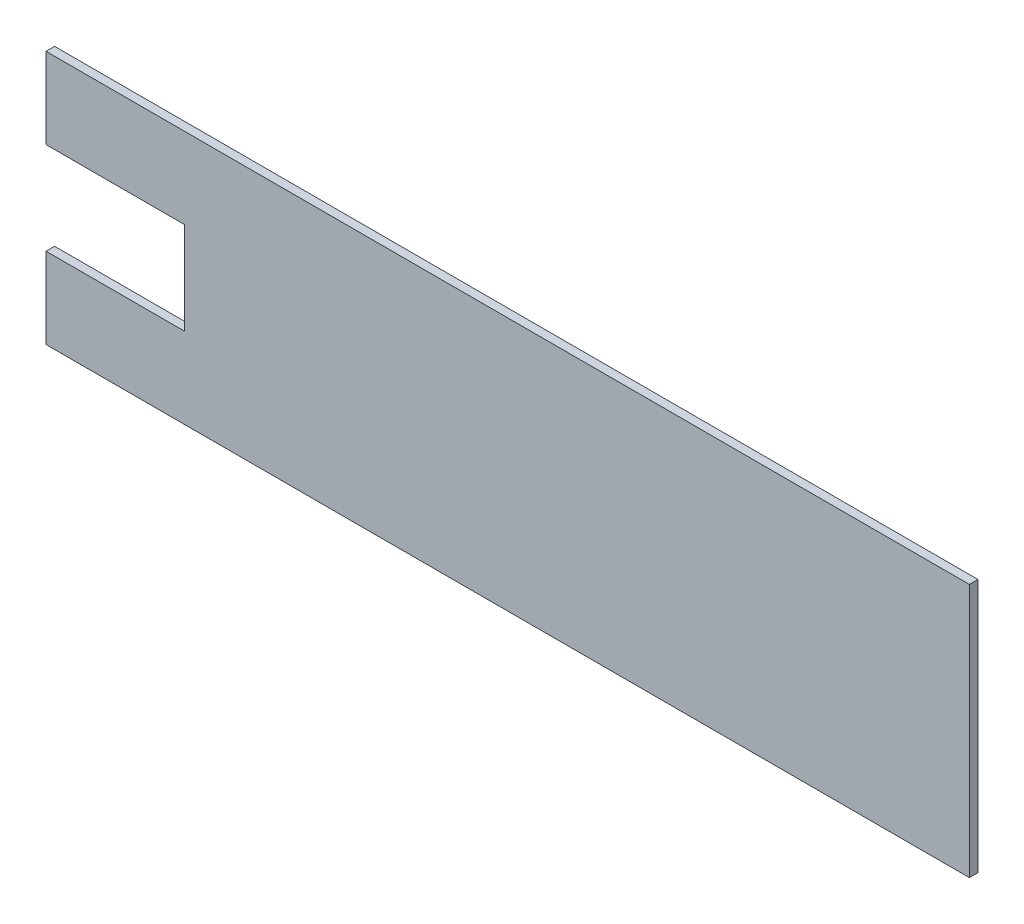
from build123d import *

# Parameters (mm, degrees)
SKETCH1_W           = 254
SKETCH1_H           = 69.85
BOSS_EXTRUDE1_DEPTH = 2.3622
SKETCH2_W           = 38.1
SKETCH2_H           = 25.4
CUT_EXTRUDE1_DEPTH  = 264.439940952


with BuildPart() as part:
    # Sketch1 → Boss-Extrude1 (new body)
    with BuildSketch(Plane.XY):
        with Locations((127, 34.925)):
            Rectangle(SKETCH1_W, SKETCH1_H)
    extrude(amount=BOSS_EXTRUDE1_DEPTH)

    # Sketch2 → Cut-Extrude1 (cut, through all)
    with BuildSketch(Plane.XY.offset(2.3622)):
        with Locations((19.05, 34.925)):
            Rectangle(SKETCH2_W, SKETCH2_H)
    extrude(amount=-CUT_EXTRUDE1_DEPTH, mode=Mode.SUBTRACT)


solid = part.part
